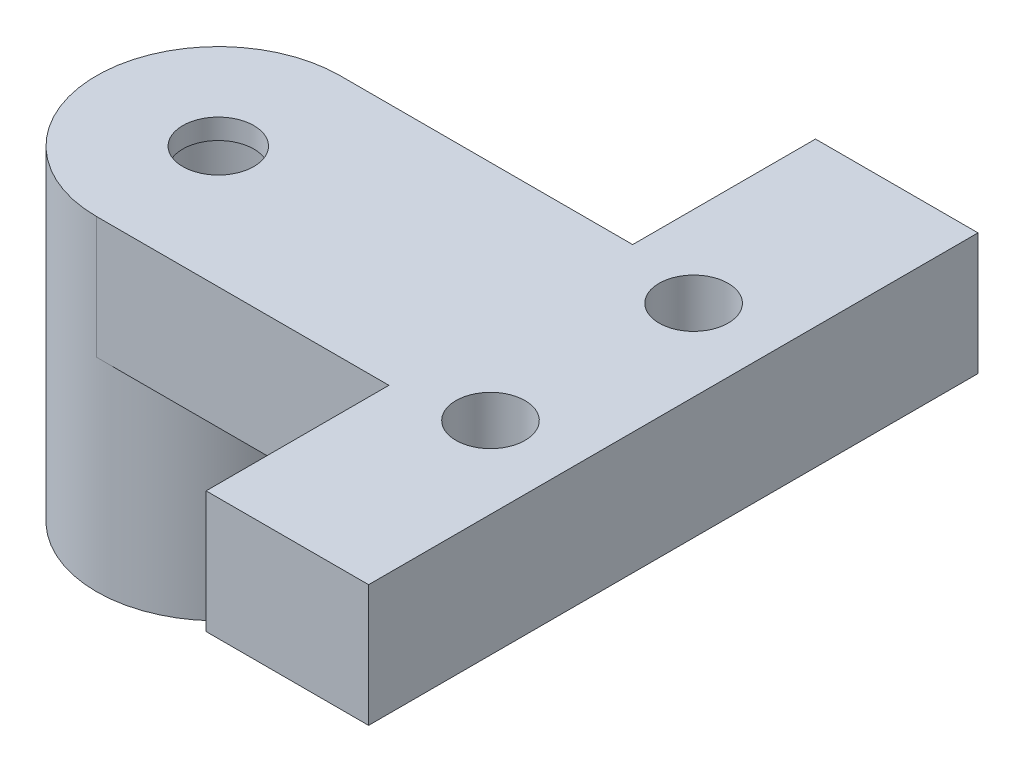
from build123d import *

# Parameters (mm, degrees)
SKETCH_1_W                = 33
SKETCH_1_H                = 6
EXTRUDE_1_DEPTH           = 30
SKETCH_3_R                = 6
EXTRUDE_2_DEPTH           = 10
SKETCH_4_R                = 3.1
CUT_EXTRUDE_1_DEPTH       = 15
SKETCH_5_R                = 1.75
CUT_EXTRUDE_2_DEPTH       = 48.053161424
EXTRUDE_3_REACH           = 49.381
EXTRUDE_3_END_RADIUS      = 6
SKETCH_10_R               = 1
HOLE_WIZARD_M4_7_D        = 3.3
HOLE_WIZARD_M4_7_DEPTH    = 15
HOLE_WIZARD_M4_7_TIP      = 0.991420021
EXTRUDE_4_REACH           = 49.381
EXTRUDE_4_END_RADIUS      = 6
SKETCH_17_R               = 1.5
HOLE_WIZARD_M4_8_D        = 3.3
HOLE_WIZARD_M4_8_DEPTH    = 13
HOLE_WIZARD_M4_8_TIP      = 0.991420021
HOLE_WIZARD_1_D           = 3.4
HOLE_WIZARD_1_CBORE_D     = 6
HOLE_WIZARD_1_CBORE_DEPTH = 3.4
CUT_EXTRUDE_3_DEPTH       = 46.70557955


with BuildPart() as part:
    # 草图1 → 凸台-拉伸1 (new body)
    with BuildSketch(Plane.XY):
        with Locations((16.5, -3)):
            Rectangle(SKETCH_1_W, SKETCH_1_H)
    extrude(amount=EXTRUDE_1_DEPTH)

    # 草图3 → 凸台-拉伸2 (add)
    with BuildSketch(Plane.XZ.offset(6)):
        with Locations(Location((10.6, 15, 0), (0, 0, 90))):
            Circle(SKETCH_3_R)
    extrude(amount=EXTRUDE_2_DEPTH)

    # 草图4 → 切除-拉伸1 (cut)
    with BuildSketch(Plane.XZ.offset(16)):
        with Locations(Location((10.6, 15, 0), (0, 0, 270))):
            Circle(SKETCH_4_R)
    extrude(amount=-CUT_EXTRUDE_1_DEPTH, mode=Mode.SUBTRACT)

    # 草图5 → 切除-拉伸2 (cut, through all)
    with BuildSketch(Plane.XZ.offset(1)):
        with Locations(Location((10.6, 15, 0), (0, 0, 270))):
            Circle(SKETCH_5_R)
    extrude(amount=-CUT_EXTRUDE_2_DEPTH, mode=Mode.SUBTRACT)

    # 凸台-拉伸3: up to this cylinder (the profile starts outside it)
    extrude_3_end = Plane(origin=(10.6, -11, 15), z_dir=(0, 1, 0)) * Cylinder(EXTRUDE_3_END_RADIUS, 111.762, mode=Mode.PRIVATE)
    # 草图10 → 凸台-拉伸3 (add, up to the surface)
    with BuildSketch(Plane.XY, mode=Mode.PRIVATE) as extrude_3_sk1:
        with Locations(Location((10.6, -11, 0), (0, 0, 180))):
            Circle(SKETCH_10_R)
    extrude_3_tool1 = extrude(extrude_3_sk1.sketch, amount=EXTRUDE_3_REACH, mode=Mode.PRIVATE) - extrude_3_end
    add(extrude_3_tool1.solids().sort_by_distance((10.6, -11, 0))[0])

    # M4 螺纹孔7
    with Locations(Plane(origin=(10.6, -11, 0), x_dir=(-1, 0, 0), z_dir=(0, 0, -1))):
        with Locations((0, 0)):
            Hole(HOLE_WIZARD_M4_7_D / 2, depth=HOLE_WIZARD_M4_7_DEPTH)
            with Locations((0, 0, -(HOLE_WIZARD_M4_7_DEPTH + HOLE_WIZARD_M4_7_TIP / 2))):  # 118° drill point
                Cone(0, HOLE_WIZARD_M4_7_D / 2, HOLE_WIZARD_M4_7_TIP, mode=Mode.SUBTRACT)

    # 凸台-拉伸4: up to this cylinder (the profile starts outside it)
    extrude_4_end = Plane(origin=(10.6, -11, 15), z_dir=(0, 1, 0)) * Cylinder(EXTRUDE_4_END_RADIUS, 111.762, mode=Mode.PRIVATE)
    # 草图17 → 凸台-拉伸4 (add, up to the surface)
    with BuildSketch(Plane(origin=(0, 0, 0), x_dir=(0, 0, -1), z_dir=(1, 0, 0)), mode=Mode.PRIVATE) as extrude_4_sk1:
        with Locations(Location((-15, -11, 0), (0, 0, 180))):
            Circle(SKETCH_17_R)
    extrude_4_tool1 = extrude(extrude_4_sk1.sketch, amount=EXTRUDE_4_REACH, mode=Mode.PRIVATE) - extrude_4_end
    add(extrude_4_tool1.solids().sort_by_distance((0, -11, 15))[0])

    # M4 螺纹孔8
    with Locations(Plane(origin=(0, -11, 15), x_dir=(0, 0, -1), z_dir=(-1, 0, 0))):
        with Locations((0, 0)):
            Hole(HOLE_WIZARD_M4_8_D / 2, depth=HOLE_WIZARD_M4_8_DEPTH)
            with Locations((0, 0, -(HOLE_WIZARD_M4_8_DEPTH + HOLE_WIZARD_M4_8_TIP / 2))):  # 118° drill point
                Cone(0, HOLE_WIZARD_M4_8_D / 2, HOLE_WIZARD_M4_8_TIP, mode=Mode.SUBTRACT)

    # 打孔尺寸(%根据)内六角圆柱头螺钉的类型1 (through all)
    with Locations(Plane(origin=(29, -6, 20), x_dir=(0, 0, -1), z_dir=(0, -1, 0))):
        with Locations((0, 0), (10, 0)):
            CounterBoreHole(HOLE_WIZARD_1_D / 2, HOLE_WIZARD_1_CBORE_D / 2, HOLE_WIZARD_1_CBORE_DEPTH)

    # 草图22 → 切除-拉伸3 (cut, through all)
    with BuildSketch(Plane.XZ.offset(6)):
        with BuildLine():
            Line((10.6, 21), (25, 21))
            Line((25, 21), (25, 30))
            Line((25, 30), (0, 30))
            Line((0, 30), (0, 0))
            Line((0, 0), (25, 0))
            Line((25, 0), (25, 9))
            Line((25, 9), (10.6, 9))
            ThreePointArc((10.6, 9), (4.6, 15), (10.6, 21))
        make_face()
    extrude(amount=-CUT_EXTRUDE_3_DEPTH, mode=Mode.SUBTRACT)


solid = part.part
